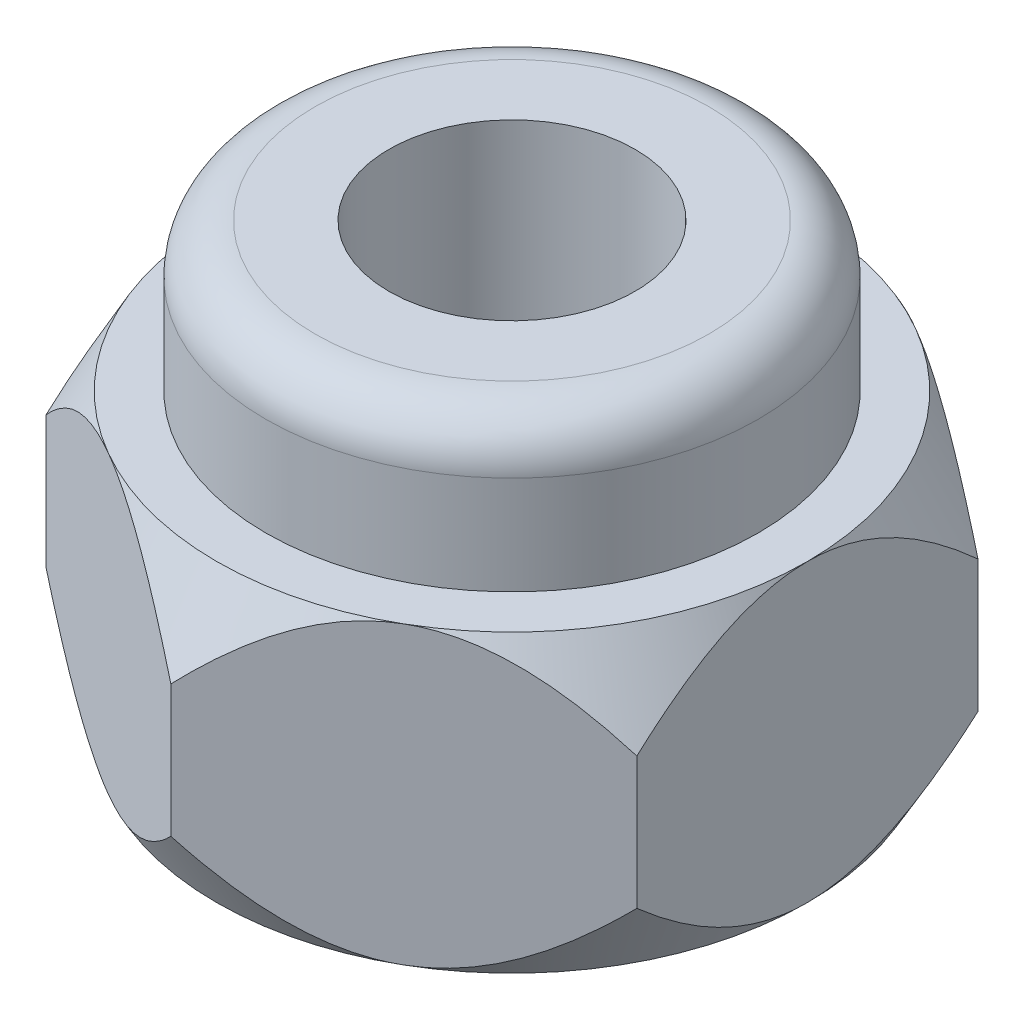
from build123d import *

# Parameters (mm, degrees)
EXTRUDE_1_DEPTH     = 3
SKETCH_2_R          = 2.5
EXTRUDE_2_DEPTH     = 1.5
FILLET_1_R          = 0.5
SKETCH_3_R          = 1.25
CUT_EXTRUDE_1_DEPTH = 7.422616289


with BuildPart() as part:
    # 草图1 → 凸台-拉伸1 (new body)
    with BuildSketch(Plane(origin=(0, 0, 0), x_dir=(1, 0, 0), z_dir=(0, 1, 0))):
        Polygon((3, 1.732050808), (0, 3.464101615), (-3, 1.732050808), (-3, -1.732050808), (0, -3.464101615), (3, -1.732050808), align=None)
    extrude(amount=EXTRUDE_1_DEPTH)

    # 草图2 → 凸台-拉伸2 (add)
    with BuildSketch(Plane(origin=(0, 3, 0), x_dir=(1, 0, 0), z_dir=(0, 1, 0))):
        with Locations(Location((0, 0, 0), (0, 0, 270))):
            Circle(SKETCH_2_R)
    extrude(amount=EXTRUDE_2_DEPTH)

    # 圆角1
    fillet_1_edges = [part.edges().sort_by_distance(p)[0] for p in [
        (0, 4.5, -2.5),
    ]]
    fillet(fillet_1_edges, radius=FILLET_1_R)

    # 草图3 → 切除-拉伸1 (cut, through all)
    with BuildSketch(Plane.XZ):
        with Locations(Location((0, 0, 0), (0, 0, 270))):
            Circle(SKETCH_3_R)
    extrude(amount=-CUT_EXTRUDE_1_DEPTH, mode=Mode.SUBTRACT)

    # 草图4 → 切除-旋转1 (revolve, cut)
    with BuildSketch(Plane.XY):
        Polygon((3.480454953, 0), (3.480454953, 0.844036103), (3, 0), align=None)
        Polygon((3, 3), (3.480454953, 3), (3.480454953, 2.125639217), align=None)
    revolve(axis=Axis((0, 0, 0), (0, 1, 0)), mode=Mode.SUBTRACT)


solid = part.part
